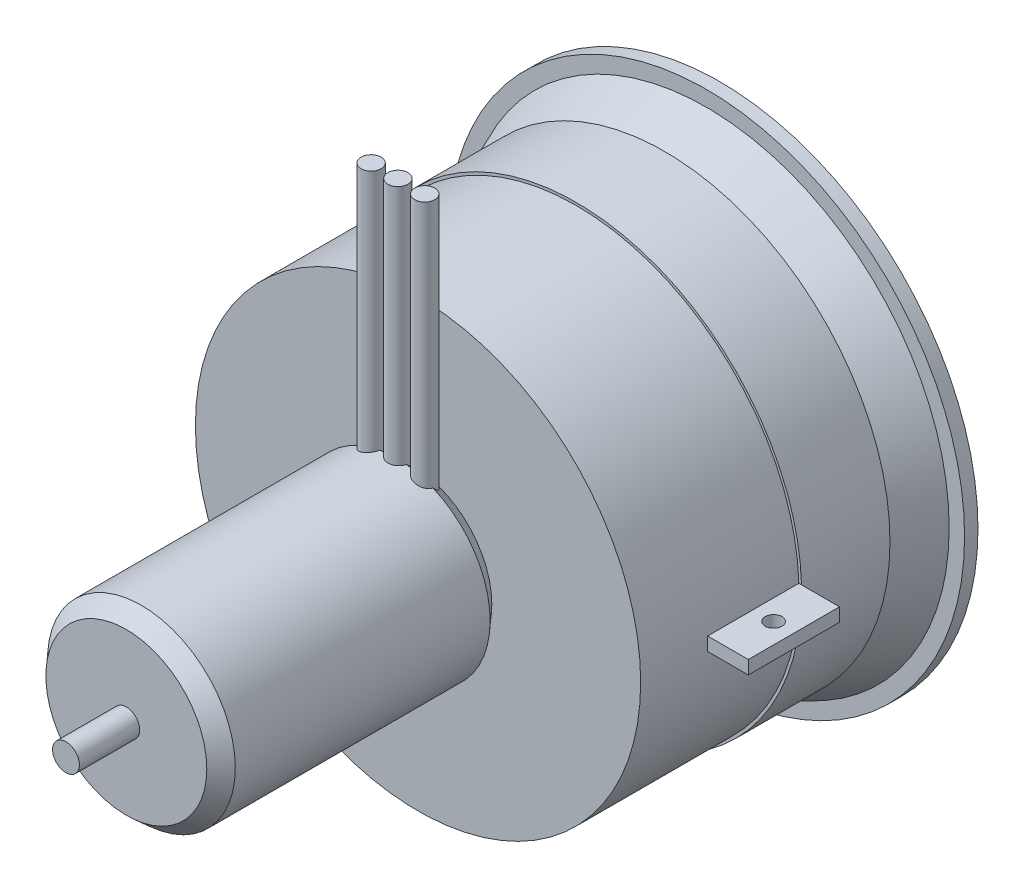
from build123d import *

# Parameters (mm, degrees)
SKETCH3_W           = 2
SKETCH3_H           = 13.6
BOSS_EXTRUDE1_DEPTH = 39.25
SKETCH4_R           = 1.25
CUT_EXTRUDE1_DEPTH  = 113.281176072
SKETCH5_R           = 1.5
BOSS_EXTRUDE5_DEPTH = 50


with BuildPart() as part:
    # Sketch1 → Revolve1 (revolve)
    with BuildSketch(Plane.YZ, mode=Mode.PRIVATE) as revolve1_sk:
        Polygon((0, 0), (38.5, 0), (38.5, 2), (36.2, 2), (33.6, 8.225), (33.6, 21.4), (33.2, 21.4), (33.2, 45), (5, 45), (5, 46), (12, 46), (14, 48.25), (14, 86.25), (12, 88.5), (2, 88.5), (2, 97.5), (0, 97.5), align=None)
    revolve(revolve1_sk.sketch.rotate(Axis((0, 0, 0), (0, 0, -1)), 90), axis=Axis((0, 0, 0), (0, 0, -1)))

    # Sketch3 → Boss-Extrude1 (add, symmetric)
    with BuildSketch(Plane.YZ):
        with Locations((0, 28.2)):
            Rectangle(SKETCH3_W, SKETCH3_H)
    extrude(amount=BOSS_EXTRUDE1_DEPTH, both=True)

    # Sketch4 → Cut-Extrude1 (cut, through all)
    with BuildSketch(Plane(origin=(0, 1, 0), x_dir=(-1, 0, 0), z_dir=(0, 1, 0))):
        with Locations(Location((-36.217468171, 28.2, 0), (0, 0, 90))):
            Circle(SKETCH4_R)
    cut_extrude1 = extrude(amount=-CUT_EXTRUDE1_DEPTH, mode=Mode.SUBTRACT)

    # Mirror1: Cut-Extrude1 across plane
    add(cut_extrude1.mirror(Plane(origin=(0, 0, 0), x_dir=(0, 0, 1), z_dir=(1, 0, 0))), mode=Mode.SUBTRACT)

    # Sketch5 → Boss-Extrude5 (add)
    with BuildSketch(Plane(origin=(0, 0, 0), x_dir=(-1, 0, 0), z_dir=(0, 1, 0))):
        with Locations(Location((0, 48, 0), (0, 0, 9.594065947))):
            Circle(SKETCH5_R)
        with Locations(Location((4, 48, 0), (0, 0, 170.405931773))):
            Circle(SKETCH5_R)
        with Locations(Location((-4, 48, 0), (0, 0, 170.405931773))):
            Circle(SKETCH5_R)
    extrude(amount=BOSS_EXTRUDE5_DEPTH)


solid = part.part
